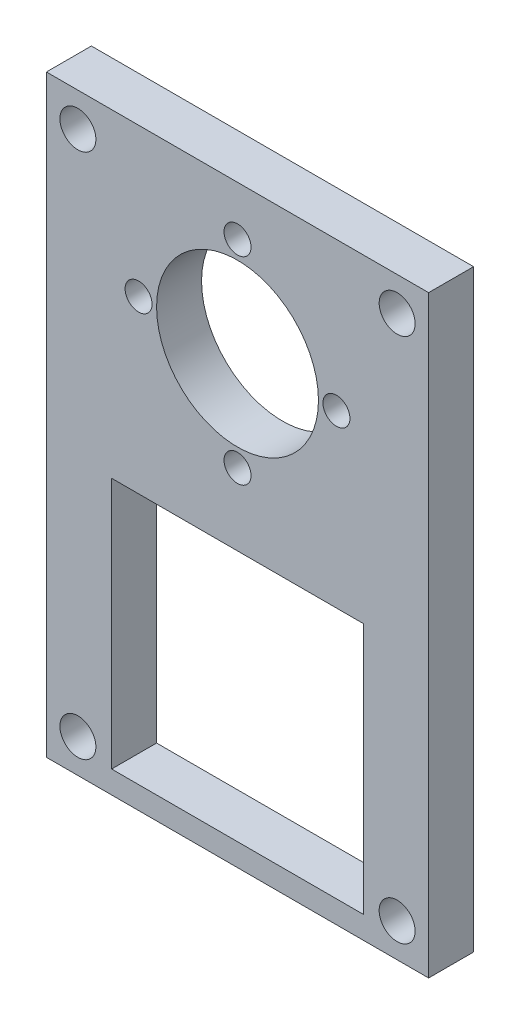
from build123d import *

# Parameters (mm, degrees)
SKETCH1_W           = 42.5
SKETCH1_H           = 66
BOSS_EXTRUDE1_DEPTH = 5
SKETCH2_R           = 9
SKETCH2_R_2         = 1.5
CUT_EXTRUDE1_DEPTH  = 40.56718969
SKETCH3_W           = 28
SKETCH3_H           = 28
CUT_EXTRUDE2_DEPTH  = 40.56718969
SKETCH4_R           = 2
CUT_EXTRUDE3_DEPTH  = 40.56718969


with BuildPart() as part:
    # Sketch1 → Boss-Extrude1 (new body)
    with BuildSketch(Plane.XY):
        Rectangle(SKETCH1_W, SKETCH1_H)
    extrude(amount=BOSS_EXTRUDE1_DEPTH)

    # Sketch2 → Cut-Extrude1 (cut, through all)
    with BuildSketch(Plane.XY.offset(5)):
        with Locations((0, 16.5)):
            Circle(SKETCH2_R)
        with Locations((0, 27.5)):
            Circle(SKETCH2_R_2)
        with Locations((11, 16.5)):
            Circle(SKETCH2_R_2)
        with Locations((-11, 16.5)):
            Circle(SKETCH2_R_2)
        with Locations((0, 5.5)):
            Circle(SKETCH2_R_2)
    extrude(amount=-CUT_EXTRUDE1_DEPTH, mode=Mode.SUBTRACT)

    # Sketch3 → Cut-Extrude2 (cut, through all)
    with BuildSketch(Plane.XY.offset(5)):
        with Locations((0, -16.5)):
            Rectangle(SKETCH3_W, SKETCH3_H)
    extrude(amount=-CUT_EXTRUDE2_DEPTH, mode=Mode.SUBTRACT)

    # Sketch4 → Cut-Extrude3 (cut, through all)
    with BuildSketch(Plane.XY.offset(5)):
        with Locations((-17.75, 29.25)):
            Circle(SKETCH4_R)
        with Locations((17.75, 29.25)):
            Circle(SKETCH4_R)
        with Locations((-17.75, -29.25)):
            Circle(SKETCH4_R)
        with Locations((17.75, -29.25)):
            Circle(SKETCH4_R)
    extrude(amount=-CUT_EXTRUDE3_DEPTH, mode=Mode.SUBTRACT)


solid = part.part
